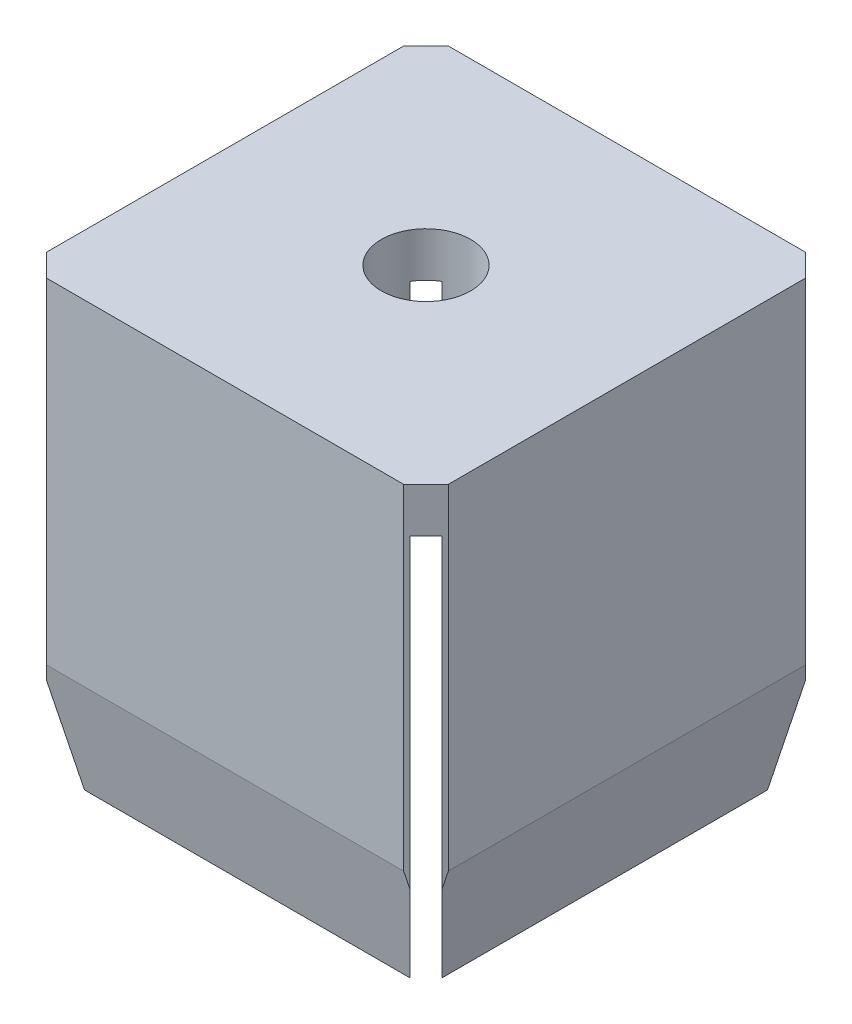
from build123d import *
from OCP.BRepFilletAPI import BRepFilletAPI_MakeChamfer

# Parameters (mm, degrees)
SKETCH1_W           = 36
SKETCH1_H           = 36
SKETCH1_R           = 4
BOSS_EXTRUDE1_DEPTH = 40
CUT_EXTRUDE1_DEPTH  = 36
CHAMFER1_SIZE       = 2
CHAMFER2_SIZE       = 2
CHAMFER2_SIZE2      = 10


with BuildPart() as part:
    # Sketch1 → Boss-Extrude1 (new body)
    with BuildSketch(Plane(origin=(0, 0, 0), x_dir=(1, 0, 0), z_dir=(0, 1, 0))):
        Rectangle(SKETCH1_W, SKETCH1_H)
        with Locations(Location((0, 0, 0), (0, 0, 270))):
            Circle(SKETCH1_R, mode=Mode.SUBTRACT)
    extrude(amount=BOSS_EXTRUDE1_DEPTH)

    # Sketch2 → Cut-Extrude1 (cut)
    with BuildSketch(Plane(origin=(0, 0, 0), x_dir=(1, 0, 0), z_dir=(0, 1, 0))):
        Polygon((-18.585786438, -20), (0, -1.414213562), (18.585786438, -20), (20, -20), (20, -18.585786438), (1.414213562, 0), (20, 18.585786438), (20, 20), (18.585786438, 20), (0, 1.414213562), (-18.585786438, 20), (-20, 20), (-20, 18.585786438), (-1.414213562, 0), (-20, -18.585786438), (-20, -20), align=None)
    extrude(amount=CUT_EXTRUDE1_DEPTH, mode=Mode.SUBTRACT)

    # Chamfer1
    chamfer1_edges = [part.edges().sort_by_distance(p)[0] for p in [
        (-18, 38, -18),
        (18, 38, -18),
        (-18, 38, 18),
        (18, 38, 18),
    ]]
    chamfer(chamfer1_edges, length=CHAMFER1_SIZE)

    # Chamfer2: one chamfer whose edges measure the first distance from different faces: ONE call of the kernel's chamfer builder (chamfer() names one face for all edges)
    chamfer2_edges_1 = [part.edges().sort_by_distance(p)[0] for p in [
        (0, 0, -18),
    ]]
    chamfer2_side_1 = [part.faces().sort_by_distance(p)[0] for p in [
        (0, 0, -12.666463052),
    ]]
    chamfer2_edges_2 = [part.edges().sort_by_distance(p)[0] for p in [
        (18, 0, 0),
    ]]
    chamfer2_side_2 = [part.faces().sort_by_distance(p)[0] for p in [
        (12.666463052, 0, 0),
    ]]
    chamfer2_edges_3 = [part.edges().sort_by_distance(p)[0] for p in [
        (0, 0, 18),
    ]]
    chamfer2_side_3 = [part.faces().sort_by_distance(p)[0] for p in [
        (0, 0, 12.666463052),
    ]]
    chamfer2_edges_4 = [part.edges().sort_by_distance(p)[0] for p in [
        (-18, 0, 0),
    ]]
    chamfer2_side_4 = [part.faces().sort_by_distance(p)[0] for p in [
        (-12.666463052, 0, 0),
    ]]
    chamfer2 = BRepFilletAPI_MakeChamfer(part.part.solid().wrapped)
    for e in chamfer2_edges_1:
        chamfer2.Add(CHAMFER2_SIZE, CHAMFER2_SIZE2, e.wrapped, chamfer2_side_1[0].wrapped)  # the first distance lies on this face
    for e in chamfer2_edges_2:
        chamfer2.Add(CHAMFER2_SIZE, CHAMFER2_SIZE2, e.wrapped, chamfer2_side_2[0].wrapped)  # the first distance lies on this face
    for e in chamfer2_edges_3:
        chamfer2.Add(CHAMFER2_SIZE, CHAMFER2_SIZE2, e.wrapped, chamfer2_side_3[0].wrapped)  # the first distance lies on this face
    for e in chamfer2_edges_4:
        chamfer2.Add(CHAMFER2_SIZE, CHAMFER2_SIZE2, e.wrapped, chamfer2_side_4[0].wrapped)  # the first distance lies on this face
    add(Compound.cast(chamfer2.Shape()), mode=Mode.REPLACE)


solid = part.part
